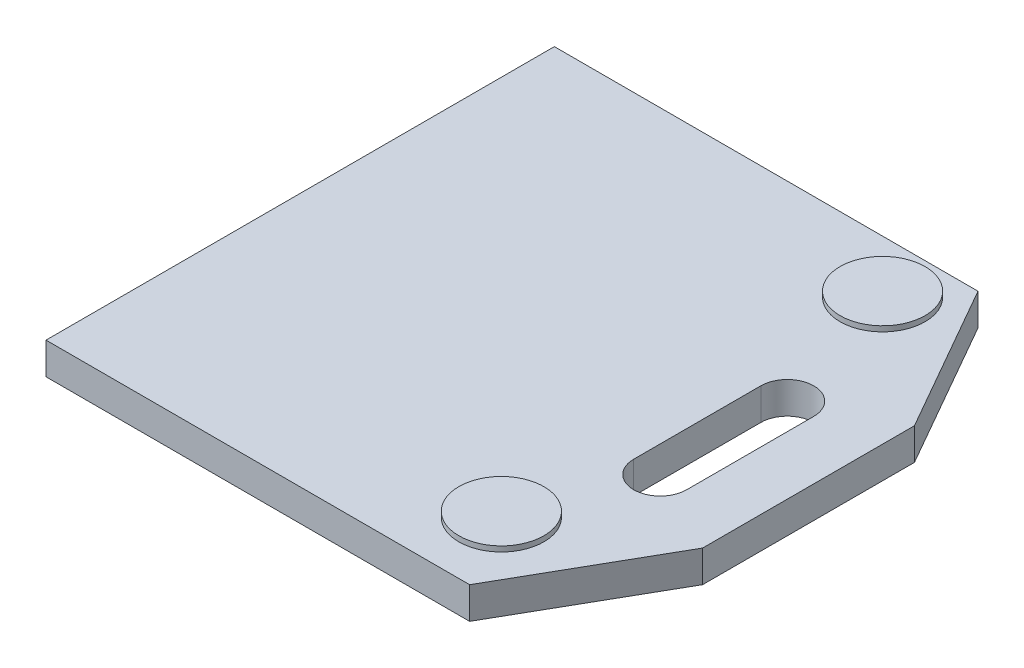
from build123d import *

# Parameters (mm, degrees)
BOSS_EXTRUDE1_DEPTH = 19.05
SKETCH4_R           = 25.488945224
SKETCH4_R_2         = 25.511029354
BOSS_EXTRUDE2_DEPTH = 3.175
CUT_EXTRUDE1_DEPTH  = 19.05


with BuildPart() as part:
    # Sketch3 → Boss-Extrude1 (new body)
    with BuildSketch(Plane(origin=(0, 0, 0), x_dir=(1, 0, 0), z_dir=(0, 1, 0))):
        Polygon((0, 0), (254, 0), (304.8, -88.9), (304.8, -215.9), (254, -304.8), (0, -304.8), align=None)
    extrude(amount=BOSS_EXTRUDE1_DEPTH)

    # Sketch4 → Boss-Extrude2 (add)
    with BuildSketch(Plane(origin=(0, 19.05, 0), x_dir=(1, 0, 0), z_dir=(0, 1, 0))):
        with Locations(Location((228.514370998, -31.725840718, 0), (0, 0, 270))):
            Circle(SKETCH4_R)
        with Locations(Location((228.514370998, -260.290019102, 0), (0, 0, 270))):
            Circle(SKETCH4_R_2)
    extrude(amount=BOSS_EXTRUDE2_DEPTH)

    # Sketch5 → Cut-Extrude1 (cut)
    with BuildSketch(Plane(origin=(0, 19.05, 0), x_dir=(1, 0, 0), z_dir=(0, 1, 0))):
        with BuildLine():
            Line((269.763997266, -114.231353373), (269.763997266, -190.431353373))
            ThreePointArc((269.763997266, -190.431353373), (253.888997266, -206.306353373), (238.013997266, -190.431353373))
            Line((238.013997266, -190.431353373), (238.013997266, -114.231353373))
            ThreePointArc((238.013997266, -114.231353373), (253.888997266, -98.356353373), (269.763997266, -114.231353373))
        make_face()
    extrude(amount=-CUT_EXTRUDE1_DEPTH, mode=Mode.SUBTRACT)


solid = part.part
